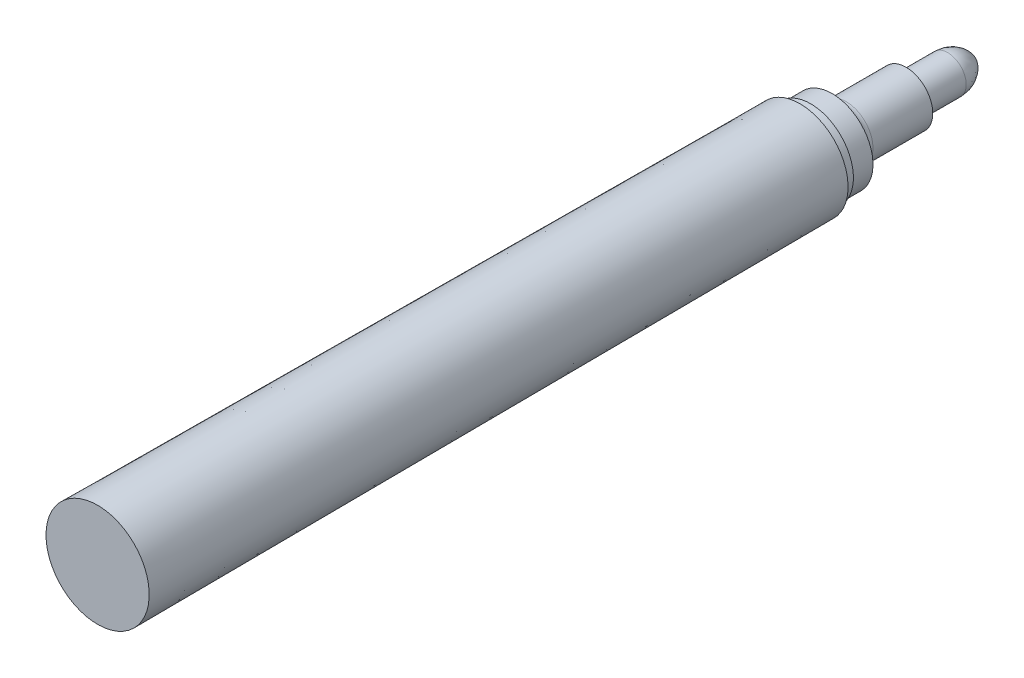
from build123d import *


with BuildPart() as part:
    # 草图1 → 旋转1 (revolve)
    with BuildSketch(Plane(origin=(0, 0, 0), x_dir=(1, 0, 0), z_dir=(0, 1, 0))):
        Polygon((0, 0), (-7.25, 0), (-6.75, 98.698733528), (0, 98.698733528), align=None)
    revolve(axis=Axis((0, 0, 0), (0, 0, 1)))

    # 草图2 → 旋转2 (revolve)
    with BuildSketch(Plane(origin=(0, 0, 0), x_dir=(1, 0, 0), z_dir=(0, 1, 0))):
        with BuildLine():
            Line((-6, 98.698733528), (-6, 100.198733528))
            Line((-6, 100.198733528), (-5.75, 100.198733528))
            Line((-5.75, 100.198733528), (-5.75, 103.198733528))
            ThreePointArc((-5.75, 103.198733528), (-4.335786438, 103.784519965), (-3.75, 105.198733528))
            Line((-3.75, 105.198733528), (-3.75, 113.598733528))
            Line((-3.75, 113.598733528), (-2.6, 113.598733528))
            Line((-2.6, 113.598733528), (-2.6, 119.451734729))
            ThreePointArc((-2.6, 119.451734729), (-1.886335345, 121.732085579), (0, 123.198733528))
            Line((0, 123.198733528), (0, 98.698733528))
            Line((0, 98.698733528), (-6, 98.698733528))
        make_face()
    revolve(axis=Axis((0, 0, -98.698733528), (0, 0, 1)))


solid = part.part
